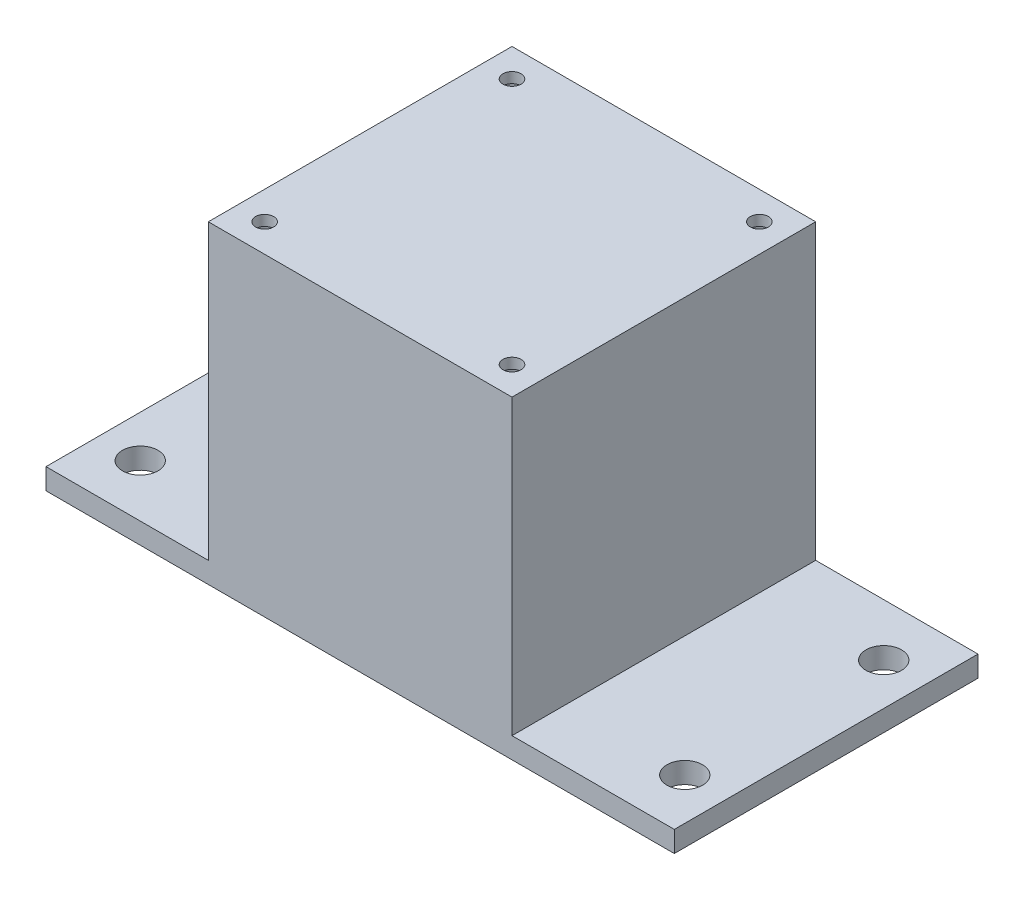
from build123d import *

# Parameters (mm, degrees)
SKETCH1_W           = 76.2
SKETCH1_H           = 36.83
SKETCH1_R           = 1.0999978
SKETCH1_R_2         = 2.159
BOSS_EXTRUDE1_DEPTH = 38.1
SKETCH3_R           = 2.54
CUT_EXTRUDE2_DEPTH  = 36.83
SKETCH4_W           = 19.685
SKETCH4_H           = 36.83
CUT_EXTRUDE3_DEPTH  = 35.56
CUT_EXTRUDE4_DEPTH  = 35.56


with BuildPart() as part:
    # Sketch1 → Boss-Extrude1 (new body)
    with BuildSketch(Plane(origin=(0, 0, 0), x_dir=(1, 0, 0), z_dir=(0, 1, 0))):
        with Locations((-1.422532637, -3.27613577)):
            Rectangle(SKETCH1_W, SKETCH1_H)
        with Locations(Location((-16.422528037, 11.72385963, 0), (0, 0, 90))):
            Circle(SKETCH1_R, mode=Mode.SUBTRACT)
        with Locations(Location((13.577462763, 11.72385963, 0), (0, 0, 90))):
            Circle(SKETCH1_R, mode=Mode.SUBTRACT)
        with Locations(Location((13.577462763, -18.27613117, 0), (0, 0, 90))):
            Circle(SKETCH1_R, mode=Mode.SUBTRACT)
        with Locations(Location((-16.422528037, -18.27613117, 0), (0, 0, 90))):
            Circle(SKETCH1_R, mode=Mode.SUBTRACT)
        with Locations(Location((31.597467363, -15.34113577, 0), (0, 0, 90))):
            Circle(SKETCH1_R_2, mode=Mode.SUBTRACT)
        with Locations(Location((31.597467363, 8.78886423, 0), (0, 0, 90))):
            Circle(SKETCH1_R_2, mode=Mode.SUBTRACT)
        with Locations(Location((-34.442532637, -15.34113577, 0), (0, 0, 90))):
            Circle(SKETCH1_R_2, mode=Mode.SUBTRACT)
        with Locations(Location((-34.442532637, 8.78886423, 0), (0, 0, 90))):
            Circle(SKETCH1_R_2, mode=Mode.SUBTRACT)
    extrude(amount=BOSS_EXTRUDE1_DEPTH)

    # Sketch3 → Cut-Extrude2 (cut)
    with BuildSketch(Plane.XZ):
        with Locations(Location((-16.422528037, 18.27613117, 0), (0, 0, 270))):
            Circle(SKETCH3_R)
        with Locations(Location((13.577462763, 18.27613117, 0), (0, 0, 90))):
            Circle(SKETCH3_R)
        with Locations(Location((13.577462763, -11.72385963, 0), (0, 0, 270))):
            Circle(SKETCH3_R)
        with Locations(Location((-16.422528037, -11.72385963, 0), (0, 0, 90))):
            Circle(SKETCH3_R)
    extrude(amount=-CUT_EXTRUDE2_DEPTH, mode=Mode.SUBTRACT)

    # Sketch4 → Cut-Extrude3 (cut)
    with BuildSketch(Plane(origin=(0, 38.1, 0), x_dir=(1, 0, 0), z_dir=(0, 1, 0))):
        with Locations((-29.680032637, -3.27613577)):
            Rectangle(SKETCH4_W, SKETCH4_H)
        with Locations((26.834967363, -3.27613577)):
            Rectangle(SKETCH4_W, SKETCH4_H)
    extrude(amount=-CUT_EXTRUDE3_DEPTH, mode=Mode.SUBTRACT)

    # Sketch5 → Cut-Extrude4 (cut)
    with BuildSketch(Plane.XZ):
        Polygon((9.767462763, -7.91385963), (9.767462763, -11.72385963), (-12.612528037, -11.72385963), (-12.612528037, -7.91385963), (-16.422528037, -7.91385963), (-16.422528037, 14.46613117), (-12.612528037, 14.46613117), (-12.612528037, 18.27613117), (9.767462763, 18.27613117), (9.767462763, 14.46613117), (13.577462763, 14.46613117), (13.577462763, -7.91385963), align=None)
    extrude(amount=-CUT_EXTRUDE4_DEPTH, mode=Mode.SUBTRACT)


solid = part.part
